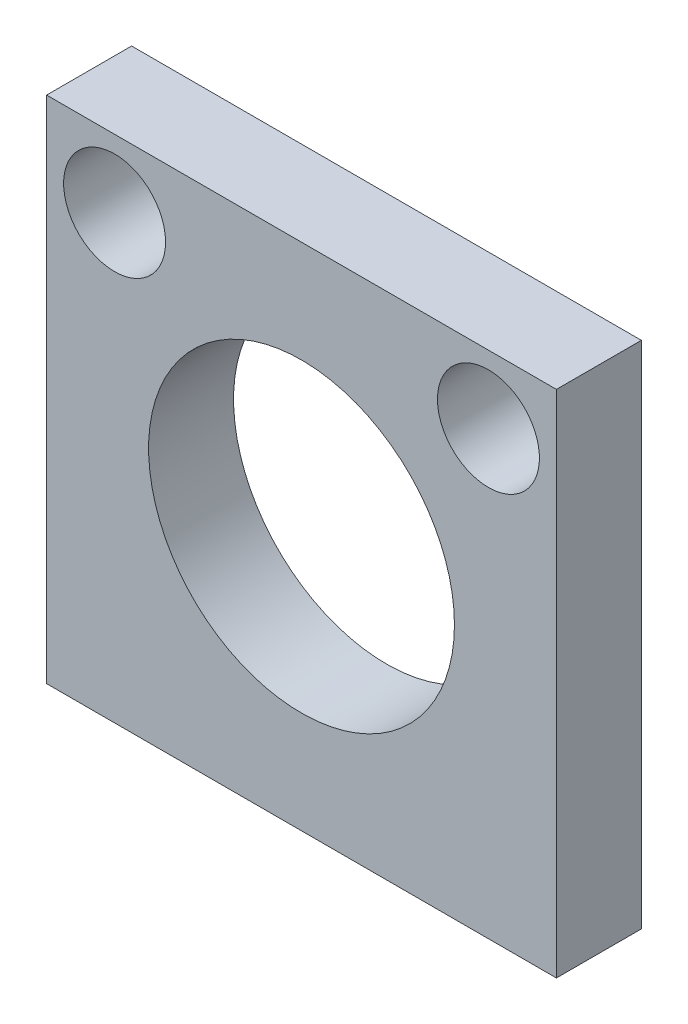
from build123d import *

# Parameters (mm, degrees)
CROQUIS1_W              = 30
CROQUIS1_H              = 30
CROQUIS1_R              = 3
SALIENTE_EXTRUIR1_DEPTH = 5
CROQUIS2_R              = 9
CORTAR_EXTRUIR1_DEPTH   = 5


with BuildPart() as part:
    # Croquis1 → Saliente-Extruir1 (new body)
    with BuildSketch(Plane.XY):
        Rectangle(CROQUIS1_W, CROQUIS1_H)
        with Locations((-11, 11)):
            Circle(CROQUIS1_R, mode=Mode.SUBTRACT)
        with Locations(Location((11, 11, 0), (0, 0, 180))):
            Circle(CROQUIS1_R, mode=Mode.SUBTRACT)
    extrude(amount=SALIENTE_EXTRUIR1_DEPTH)

    # Croquis2 → Cortar-Extruir1 (cut)
    with BuildSketch(Plane.XY.offset(5)):
        Circle(CROQUIS2_R)
    extrude(amount=-CORTAR_EXTRUIR1_DEPTH, mode=Mode.SUBTRACT)


solid = part.part
